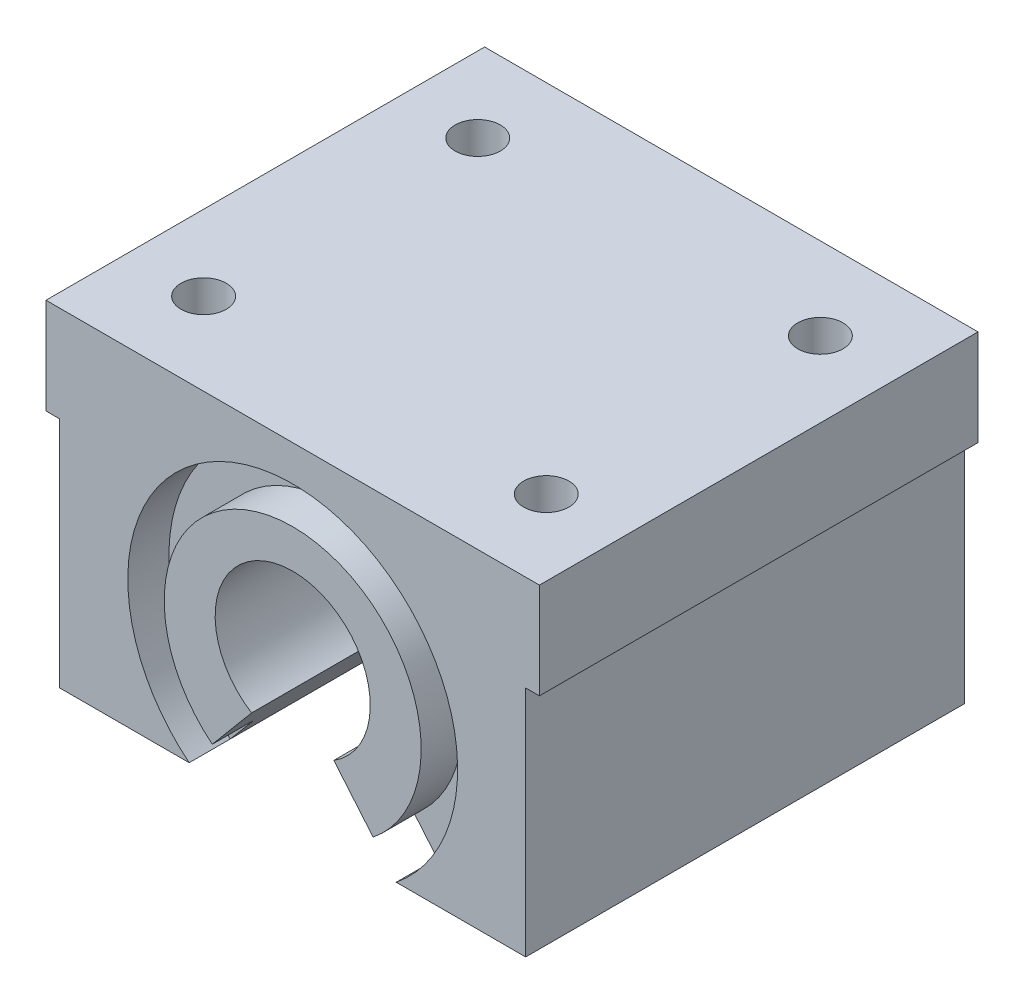
from build123d import *

# Parameters (mm, degrees)
EXTRUDE_1_DEPTH     = 16
CUT_EXTRUDE_1_DEPTH = 3


with BuildPart() as part:
    # 草图1 → 凸台-拉伸1 (new, symmetric)
    with BuildSketch(Plane.XY):
        with BuildLine():
            Line((-18, 0), (18, 0))
            Line((18, 0), (18, -7))
            Line((18, -7), (17, -7))
            Line((17, -7), (17, -24))
            Line((17, -24), (7.551896681, -24))
            Line((7.551896681, -24), (3, -18.575260778))
            ThreePointArc((3, -18.575260778), (0, -8.115719133), (-3, -18.575260778))
            Line((-3, -18.575260778), (-7.551896681, -24))
            Line((-7.551896681, -24), (-17, -24))
            Line((-17, -24), (-17, -7))
            Line((-17, -7), (-18, -7))
            Line((-18, -7), (-18, 0))
        make_face()
    extrude(amount=EXTRUDE_1_DEPTH, both=True)

    # 草图2 → 切除-拉伸1 (cut)
    with BuildSketch(Plane.XY.offset(16)):
        with BuildLine():
            Line((-7.551896681, -24), (-5.866143417, -21.990997492))
            ThreePointArc((-5.866143417, -21.990997492), (0, -5.306607169), (5.866143417, -21.990997492))
            Line((5.866143417, -21.990997492), (7.551896681, -24))
            ThreePointArc((7.551896681, -24), (0, -2.604245979), (-7.551896681, -24))
        make_face()
    extrude(amount=-CUT_EXTRUDE_1_DEPTH, mode=Mode.SUBTRACT)

    # 草图4 → M4 螺纹孔的螺纹孔钻头1 (revolve, cut)
    with BuildSketch(Plane(origin=(-12.5, 0, 10), x_dir=(0, 0, 1), z_dir=(1, 0, 0))):
        Polygon((0, 0), (0, 10.991420021), (1.65, 10), (1.65, 0), align=None)
    hole_wizard_m4_1 = revolve(axis=Axis((-12.5, 6.35, 10), (0, -1, 0)), mode=Mode.SUBTRACT)

    # 镜向1: M4 螺纹孔的螺纹孔钻头1 across plane
    add(hole_wizard_m4_1.mirror(Plane.XY), mode=Mode.SUBTRACT)

    # 镜向2: M4 螺纹孔的螺纹孔钻头1 across plane
    add(hole_wizard_m4_1.mirror(Plane(origin=(0, 0, 0), x_dir=(0, 0, 1), z_dir=(1, 0, 0))), mode=Mode.SUBTRACT)

    # 镜向2 copy 1 sketch → 镜向2 copy 1 (revolve, cut)
    with BuildSketch(Plane(origin=(12.5, 0, -10), x_dir=(0, 0, -1), z_dir=(-1, 0, 0))):
        Polygon((0, 0), (0, 10.991420021), (1.65, 10), (1.65, 0), align=None)
    revolve(axis=Axis((12.5, 6.35, -10), (0, -1, 0)), mode=Mode.SUBTRACT)


solid = part.part
